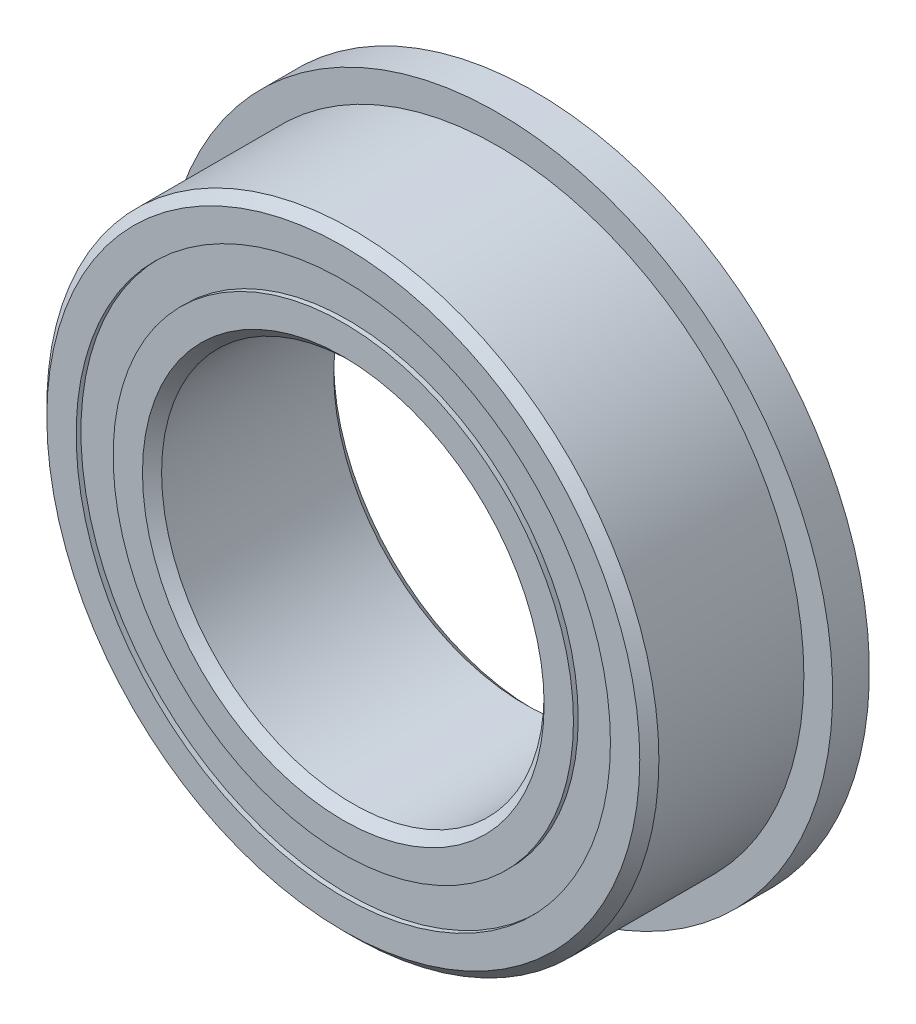
from build123d import *

# Parameters (mm, degrees)
CIRPATTERN1_COUNT = 16
SKETCH5_W         = 0.923323783
SKETCH5_H         = 0.767582418
SKETCH6_W         = 0.762
SKETCH6_H         = 1.403733791


with BuildPart() as part:
    # Sketch1 → Revolve1 (revolve)
    with BuildSketch(Plane(origin=(0, 0, 0), x_dir=(0, 0, -1), z_dir=(1, 0, 0))):
        with BuildLine():
            Line((1.7859375, 6.35), (-1.7859375, 6.35))
            Line((-1.7859375, 6.35), (-1.984375, 6.1515625))
            Line((-1.984375, 6.1515625), (-1.984375, 5.543166209))
            Line((-1.984375, 5.543166209), (-0.881944444, 5.543166209))
            ThreePointArc((-0.881944444, 5.543166209), (0, 6.121207467), (0.881944444, 5.543166209))
            Line((0.881944444, 5.543166209), (1.984375, 5.543166209))
            Line((1.984375, 5.543166209), (1.984375, 6.1515625))
            Line((1.984375, 6.1515625), (1.7859375, 6.35))
        make_face()
    revolve(axis=Axis((0, 0, 1.984375), (0, 0, -1)))

    # Sketch6 → Revolve6 (revolve)
    with BuildSketch(Plane(origin=(0, 0, 0), x_dir=(0, 0, -1), z_dir=(1, 0, 0))):
        with Locations((1.603375, 6.245033105)):
            Rectangle(SKETCH6_W, SKETCH6_H)
    revolve(axis=Axis((0, 0, -1.984375), (0, 0, 1)))


with BuildPart() as body_2:
    # Sketch3 → Revolve3 (revolve)
    with BuildSketch(Plane(origin=(0, 0, 0), x_dir=(0, 0, -1), z_dir=(1, 0, 0))):
        with BuildLine():
            Line((-1.984375, 4.775583791), (-0.881944444, 4.775583791))
            ThreePointArc((-0.881944444, 4.775583791), (0, 4.197542533), (0.881944444, 4.775583791))
            Line((0.881944444, 4.775583791), (1.984375, 4.775583791))
            Line((1.984375, 4.775583791), (1.984375, 4.1671875))
            Line((1.984375, 4.1671875), (1.7859375, 3.96875))
            Line((1.7859375, 3.96875), (-1.7859375, 3.96875))
            Line((-1.7859375, 3.96875), (-1.984375, 4.1671875))
            Line((-1.984375, 4.1671875), (-1.984375, 4.775583791))
        make_face()
    revolve(axis=Axis((0, 0, 1.984375), (0, 0, -1)))


with BuildPart() as body_3:
    # Sketch4 → Revolve4 (revolve)
    with BuildSketch(Plane(origin=(0, 0, 0), x_dir=(0, 0, -1), z_dir=(1, 0, 0))):
        with BuildLine():
            Line((-0.961832467, 5.159375), (0.961832467, 5.159375))
            ThreePointArc((0.961832467, 5.159375), (0, 6.121207467), (-0.961832467, 5.159375))
        make_face()
    revolve(axis=Axis((0, 5.159375, 0.961832467), (0, 0, -1)))


with BuildPart() as cirpattern1_1:
    # CirPattern1: pattern copy
    add(body_3.part.rotate(Axis((0, 0, -1.984375), (0, 0, 1)), 1 * 360 / CIRPATTERN1_COUNT))


with BuildPart() as cirpattern1_2:
    # CirPattern1: pattern copy
    add(body_3.part.rotate(Axis((0, 0, -1.984375), (0, 0, 1)), 2 * 360 / CIRPATTERN1_COUNT))


with BuildPart() as cirpattern1_3:
    # CirPattern1: pattern copy
    add(body_3.part.rotate(Axis((0, 0, -1.984375), (0, 0, 1)), 3 * 360 / CIRPATTERN1_COUNT))


with BuildPart() as cirpattern1_4:
    # CirPattern1: pattern copy
    add(body_3.part.rotate(Axis((0, 0, -1.984375), (0, 0, 1)), 4 * 360 / CIRPATTERN1_COUNT))


with BuildPart() as cirpattern1_5:
    # CirPattern1: pattern copy
    add(body_3.part.rotate(Axis((0, 0, -1.984375), (0, 0, 1)), 5 * 360 / CIRPATTERN1_COUNT))


with BuildPart() as cirpattern1_6:
    # CirPattern1: pattern copy
    add(body_3.part.rotate(Axis((0, 0, -1.984375), (0, 0, 1)), 6 * 360 / CIRPATTERN1_COUNT))


with BuildPart() as cirpattern1_7:
    # CirPattern1: pattern copy
    add(body_3.part.rotate(Axis((0, 0, -1.984375), (0, 0, 1)), 7 * 360 / CIRPATTERN1_COUNT))


with BuildPart() as cirpattern1_8:
    # CirPattern1: pattern copy
    add(body_3.part.rotate(Axis((0, 0, -1.984375), (0, 0, 1)), 8 * 360 / CIRPATTERN1_COUNT))


with BuildPart() as cirpattern1_9:
    # CirPattern1: pattern copy
    add(body_3.part.rotate(Axis((0, 0, -1.984375), (0, 0, 1)), 9 * 360 / CIRPATTERN1_COUNT))


with BuildPart() as cirpattern1_10:
    # CirPattern1: pattern copy
    add(body_3.part.rotate(Axis((0, 0, -1.984375), (0, 0, 1)), 10 * 360 / CIRPATTERN1_COUNT))


with BuildPart() as cirpattern1_11:
    # CirPattern1: pattern copy
    add(body_3.part.rotate(Axis((0, 0, -1.984375), (0, 0, 1)), 11 * 360 / CIRPATTERN1_COUNT))


with BuildPart() as cirpattern1_12:
    # CirPattern1: pattern copy
    add(body_3.part.rotate(Axis((0, 0, -1.984375), (0, 0, 1)), 12 * 360 / CIRPATTERN1_COUNT))


with BuildPart() as cirpattern1_13:
    # CirPattern1: pattern copy
    add(body_3.part.rotate(Axis((0, 0, -1.984375), (0, 0, 1)), 13 * 360 / CIRPATTERN1_COUNT))


with BuildPart() as cirpattern1_14:
    # CirPattern1: pattern copy
    add(body_3.part.rotate(Axis((0, 0, -1.984375), (0, 0, 1)), 14 * 360 / CIRPATTERN1_COUNT))


with BuildPart() as cirpattern1_15:
    # CirPattern1: pattern copy
    add(body_3.part.rotate(Axis((0, 0, -1.984375), (0, 0, 1)), 15 * 360 / CIRPATTERN1_COUNT))


with BuildPart() as body_19:
    # Sketch5 → Revolve5 (revolve)
    with BuildSketch(Plane(origin=(0, 0, 0), x_dir=(0, 0, -1), z_dir=(1, 0, 0))):
        with Locations((-1.423494359, 5.159375)):
            Rectangle(SKETCH5_W, SKETCH5_H)
        with Locations((1.423494359, 5.159375)):
            Rectangle(SKETCH5_W, SKETCH5_H)
    revolve(axis=Axis((0, 0, 1.984375), (0, 0, -1)))


solid = Compound([part.part, body_2.part, body_3.part, cirpattern1_1.part, cirpattern1_2.part, cirpattern1_3.part, cirpattern1_4.part, cirpattern1_5.part, cirpattern1_6.part, cirpattern1_7.part, cirpattern1_8.part, cirpattern1_9.part, cirpattern1_10.part, cirpattern1_11.part, cirpattern1_12.part, cirpattern1_13.part, cirpattern1_14.part, cirpattern1_15.part, body_19.part])
